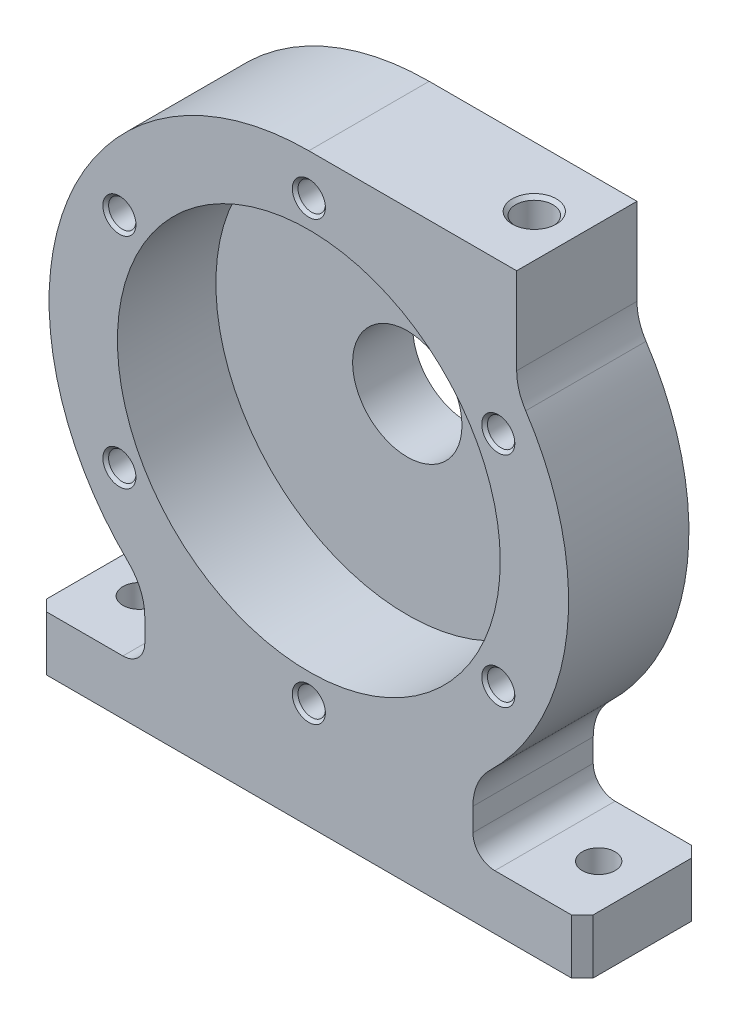
from build123d import *

# Parameters (mm, degrees)
BOSS_EXTRUDE1_DEPTH                                 = 22
SKETCH2_R                                           = 35
CUT_EXTRUDE1_DEPTH                                  = 18
SKETCH3_R                                           = 14
BOSS_EXTRUDE2_DEPTH                                 = 7
FILLET1_R                                           = 4
SKETCH4_R                                           = 10
CUT_EXTRUDE2_DEPTH                                  = 83.953300115
CHAMFER1_SIZE                                       = 2
M8X1_25_TAPPED_HOLE1_D                              = 6.8
M8X1_25_TAPPED_HOLE1_DEPTH                          = 29.75
M8X1_25_TAPPED_HOLE1_CSINK_D                        = 8.05
M8X1_25_TAPPED_HOLE1_CSINK_ANGLE                    = 90
M8X1_25_TAPPED_HOLE1_TIP                            = 2.042926105
CIRPATTERN1_COUNT                                   = 6
CSK_FOR_M8_COUNTERSUNK_FLAT_HEAD_SCREW1_D           = 6
CSK_FOR_M8_COUNTERSUNK_FLAT_HEAD_SCREW1_DEPTH       = 20
CSK_FOR_M8_COUNTERSUNK_FLAT_HEAD_SCREW1_CSINK_D     = 8
CSK_FOR_M8_COUNTERSUNK_FLAT_HEAD_SCREW1_CSINK_ANGLE = 90
CSK_FOR_M8_COUNTERSUNK_FLAT_HEAD_SCREW1_TIP         = 1.802581857


with BuildPart() as part:
    # Sketch1 → Boss-Extrude1 (new body)
    with BuildSketch(Plane.XY):
        with BuildLine():
            Line((-50, -59.5), (50, -59.5))
            Line((50, -59.5), (50, -49.5))
            Line((50, -49.5), (34, -49.5))
            ThreePointArc((34, -49.5), (31.171572875, -48.328427125), (30, -45.5))
            Line((30, -45.5), (30, -41.306779105))
            ThreePointArc((30, -41.306779105), (30.792252789, -37.405831617), (33.043478261, -34.122991434))
            ThreePointArc((33.043478261, -34.122991434), (47.217043986, -5.176944775), (39.652173913, 26.152535326))
            ThreePointArc((39.652173913, 26.152535326), (38.421945373, 28.784159388), (38, 31.658332237))
            Line((38, 31.658332237), (38, 47.5))
            Line((38, 47.5), (0, 47.5))
            ThreePointArc((0, 47.5), (-44.028922841, 17.824251834), (-33.043478261, -34.122991434))
            ThreePointArc((-33.043478261, -34.122991434), (-30.792252789, -37.405831617), (-30, -41.306779105))
            Line((-30, -41.306779105), (-30, -45.5))
            ThreePointArc((-30, -45.5), (-31.171572875, -48.328427125), (-34, -49.5))
            Line((-34, -49.5), (-50, -49.5))
            Line((-50, -49.5), (-50, -59.5))
        make_face()
    extrude(amount=BOSS_EXTRUDE1_DEPTH)

    # Sketch2 → Cut-Extrude1 (cut)
    with BuildSketch(Plane.XY.offset(22)):
        Circle(SKETCH2_R)
    extrude(amount=-CUT_EXTRUDE1_DEPTH, mode=Mode.SUBTRACT)

    # Sketch3 → Boss-Extrude2 (add)
    with BuildSketch(Plane(origin=(0, 0, 0), x_dir=(-1, 0, 0), z_dir=(0, 0, -1))):
        Circle(SKETCH3_R)
    extrude(amount=BOSS_EXTRUDE2_DEPTH)

    # Fillet1
    fillet1_edges = [part.edges().sort_by_distance(p)[0] for p in [
        (14, 0, 0),
    ]]
    fillet(fillet1_edges, radius=FILLET1_R)

    # Sketch4 → Cut-Extrude2 (cut, through all)
    with BuildSketch(Plane(origin=(0, 0, -7), x_dir=(-1, 0, 0), z_dir=(0, 0, -1))):
        Circle(SKETCH4_R)
    extrude(amount=-CUT_EXTRUDE2_DEPTH, mode=Mode.SUBTRACT)

    # Chamfer1
    chamfer1_edges = [part.edges().sort_by_distance(p)[0] for p in [
        (50, -54.5, 0),
        (-50, -54.5, 0),
        (-50, -54.5, 22),
        (50, -54.5, 22),
    ]]
    chamfer(chamfer1_edges, length=CHAMFER1_SIZE)

    # M8x1.25 Tapped Hole1
    with Locations(Plane(origin=(0, 47.5, 0), x_dir=(1, 0, 0), z_dir=(0, 1, 0))):
        with Locations((30.22415, -11)):
            CounterSinkHole(M8X1_25_TAPPED_HOLE1_D / 2, M8X1_25_TAPPED_HOLE1_CSINK_D / 2, depth=M8X1_25_TAPPED_HOLE1_DEPTH, counter_sink_angle=M8X1_25_TAPPED_HOLE1_CSINK_ANGLE)
            with Locations((0, 0, -(M8X1_25_TAPPED_HOLE1_DEPTH + M8X1_25_TAPPED_HOLE1_TIP / 2))):  # 118° drill point
                Cone(0, M8X1_25_TAPPED_HOLE1_D / 2, M8X1_25_TAPPED_HOLE1_TIP, mode=Mode.SUBTRACT)

    # Sketch10 → M6x1.0 Tapped Hole1 (revolve, cut)
    with BuildSketch(Plane(origin=(0, 40, 22), x_dir=(0, -1, 0), z_dir=(1, 0, 0))):
        Polygon((0, 0), (0, 16.502151548), (2.5, 15), (2.5, 0.525), (3.025, 0), align=None)
    m6x1_0_tapped_hole1 = revolve(axis=Axis((0, 40, 28.35), (0, 0, -1)), mode=Mode.SUBTRACT)

    # CirPattern1: M6x1.0 Tapped Hole1 ×6 about axis
    cirpattern1_axis = Axis((0, 0, 0), (0, 0, 1))
    for i in range(1, CIRPATTERN1_COUNT):
        add(m6x1_0_tapped_hole1.rotate(cirpattern1_axis, i * 360 / CIRPATTERN1_COUNT), mode=Mode.SUBTRACT)

    # CSK for M8 Countersunk Flat Head Screw1
    with Locations(Plane(origin=(0, -59.5, 0), x_dir=(-1, 0, 0), z_dir=(0, -1, 0))):
        with Locations((42, -11), (-42, -11)):
            CounterSinkHole(CSK_FOR_M8_COUNTERSUNK_FLAT_HEAD_SCREW1_D / 2, CSK_FOR_M8_COUNTERSUNK_FLAT_HEAD_SCREW1_CSINK_D / 2, depth=CSK_FOR_M8_COUNTERSUNK_FLAT_HEAD_SCREW1_DEPTH, counter_sink_angle=CSK_FOR_M8_COUNTERSUNK_FLAT_HEAD_SCREW1_CSINK_ANGLE)
            with Locations((0, 0, -(CSK_FOR_M8_COUNTERSUNK_FLAT_HEAD_SCREW1_DEPTH + CSK_FOR_M8_COUNTERSUNK_FLAT_HEAD_SCREW1_TIP / 2))):  # 118° drill point
                Cone(0, CSK_FOR_M8_COUNTERSUNK_FLAT_HEAD_SCREW1_D / 2, CSK_FOR_M8_COUNTERSUNK_FLAT_HEAD_SCREW1_TIP, mode=Mode.SUBTRACT)


solid = part.part
